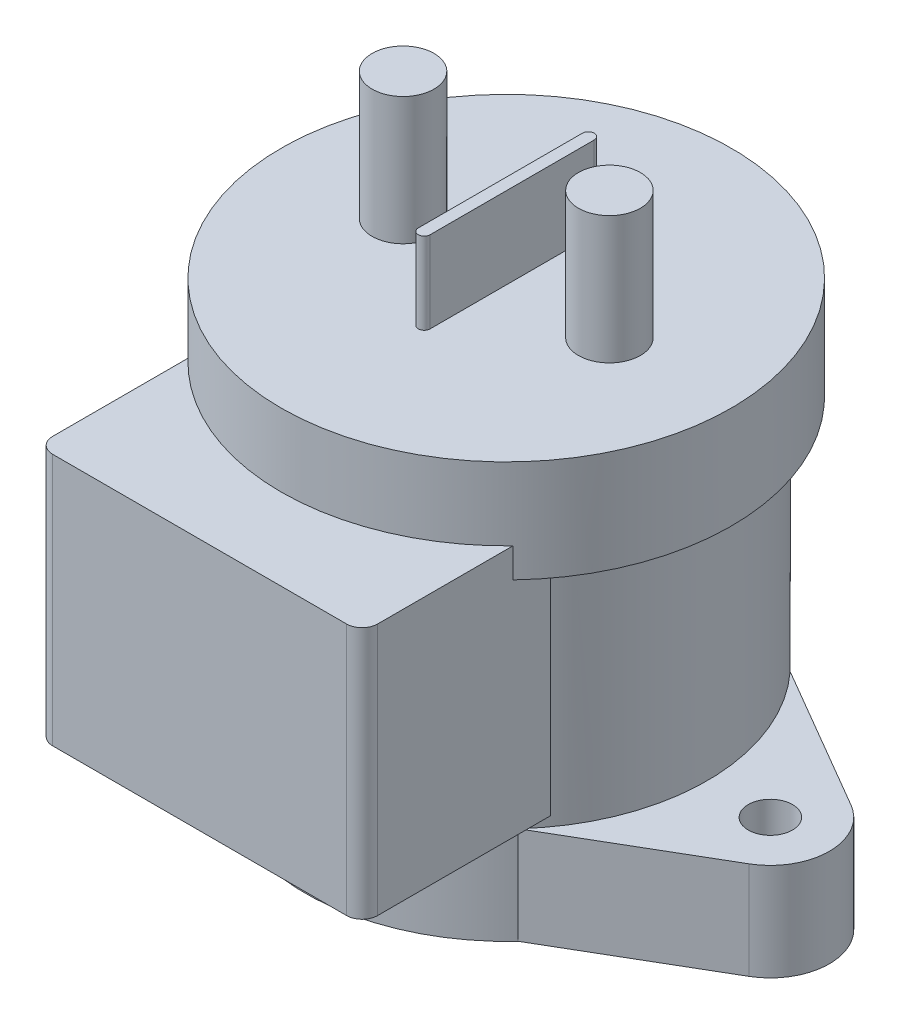
from build123d import *

# Parameters (mm, degrees)
SKETCH1_R           = 29.095
BOSS_EXTRUDE1_DEPTH = 13.208
SKETCH2_R           = 25.97
BOSS_EXTRUDE2_DEPTH = 42.672
BOSS_EXTRUDE3_START = -12.6
SKETCH3_R           = 2.86
BOSS_EXTRUDE3_DEPTH = 12.6
SKETCH4_R           = 4
BOSS_EXTRUDE4_DEPTH = 16.49
BOSS_EXTRUDE5_DEPTH = 10.541
BOSS_EXTRUDE6_START = -46.482
BOSS_EXTRUDE6_DEPTH = 32.639


with BuildPart() as part:
    # Sketch1 → Boss-Extrude1 (new body)
    with BuildSketch(Plane(origin=(0, 0, 0), x_dir=(1, 0, 0), z_dir=(0, 1, 0))):
        with Locations(Location((0, 0, 0), (0, 0, 270))):
            Circle(SKETCH1_R)
    extrude(amount=-BOSS_EXTRUDE1_DEPTH)

    # Sketch2 → Boss-Extrude2 (add)
    with BuildSketch(Plane.XZ.offset(13.208)):
        with Locations(Location((0, 0, 0), (0, 0, 90))):
            Circle(SKETCH2_R)
    extrude(amount=BOSS_EXTRUDE2_DEPTH)

    # Sketch3 → Boss-Extrude3 (add)
    # profile 1 of 2: a face of its own
    with BuildSketch(Plane.XZ.offset(55.88).offset(BOSS_EXTRUDE3_START)):
        with BuildLine():
            Line((37.979011894, -6.582278305), (19.106291889, -17.5895))
            ThreePointArc((19.106291889, -17.5895), (25.97, 0), (19.106291889, 17.5895))
            Line((19.106291889, 17.5895), (37.979011894, 6.582278305))
            ThreePointArc((37.979011894, 6.582278305), (41.76, 0), (37.979011894, -6.582278305))
        make_face()
        with Locations(Location((34.14, 0, 0), (0, 0, 270))):
            Circle(SKETCH3_R, mode=Mode.SUBTRACT)
    # profile 2 of 2: a face of its own
    with BuildSketch(Plane.XZ.offset(55.88).offset(BOSS_EXTRUDE3_START)):
        with BuildLine():
            Line((-37.979011894, 6.582278305), (-19.106291889, 17.5895))
            ThreePointArc((-19.106291889, 17.5895), (-25.97, 0), (-19.106291889, -17.5895))
            Line((-19.106291889, -17.5895), (-37.979011894, -6.582278305))
            ThreePointArc((-37.979011894, -6.582278305), (-41.76, 0), (-37.979011894, 6.582278305))
        make_face()
        with Locations(Location((-34.14, 0, 0), (0, 0, 90))):
            Circle(SKETCH3_R, mode=Mode.SUBTRACT)
    extrude(amount=BOSS_EXTRUDE3_DEPTH)

    # Sketch4 → Boss-Extrude4 (add)
    with BuildSketch(Plane(origin=(0, 0, 0), x_dir=(1, 0, 0), z_dir=(0, 1, 0))):
        with Locations(Location((13.335, 0, 0), (0, 0, 270))):
            Circle(SKETCH4_R)
        with Locations(Location((-13.335, 0, 0), (0, 0, 90))):
            Circle(SKETCH4_R)
    extrude(amount=BOSS_EXTRUDE4_DEPTH)

    # Sketch5 → Boss-Extrude5 (add)
    with BuildSketch(Plane(origin=(0, 0, 0), x_dir=(1, 0, 0), z_dir=(0, 1, 0))):
        with BuildLine():
            Line((-0.762, 10.603000191), (-0.762, -10.603000191))
            ThreePointArc((-0.762, -10.603000191), (0, -11.365), (0.762, -10.603000191))
            Line((0.762, -10.603000191), (0.762, 10.603000191))
            ThreePointArc((0.762, 10.603000191), (0, 11.365), (-0.762, 10.603000191))
        make_face()
    extrude(amount=BOSS_EXTRUDE5_DEPTH)

    # Sketch6 → Boss-Extrude6 (add)
    with BuildSketch(Plane.XZ.offset(55.88).offset(BOSS_EXTRUDE6_START)):
        with BuildLine():
            Line((-19, 39.63), (19, 39.63))
            ThreePointArc((19, 39.63), (20.414213562, 39.044213562), (21, 37.63))
            Line((21, 37.63), (21, 15.278772856))
            ThreePointArc((21, 15.278772856), (0, 25.97), (-21, 15.278772856))
            Line((-21, 15.278772856), (-21, 37.63))
            ThreePointArc((-21, 37.63), (-20.414213562, 39.044213562), (-19, 39.63))
        make_face()
    extrude(amount=BOSS_EXTRUDE6_DEPTH)


solid = part.part
